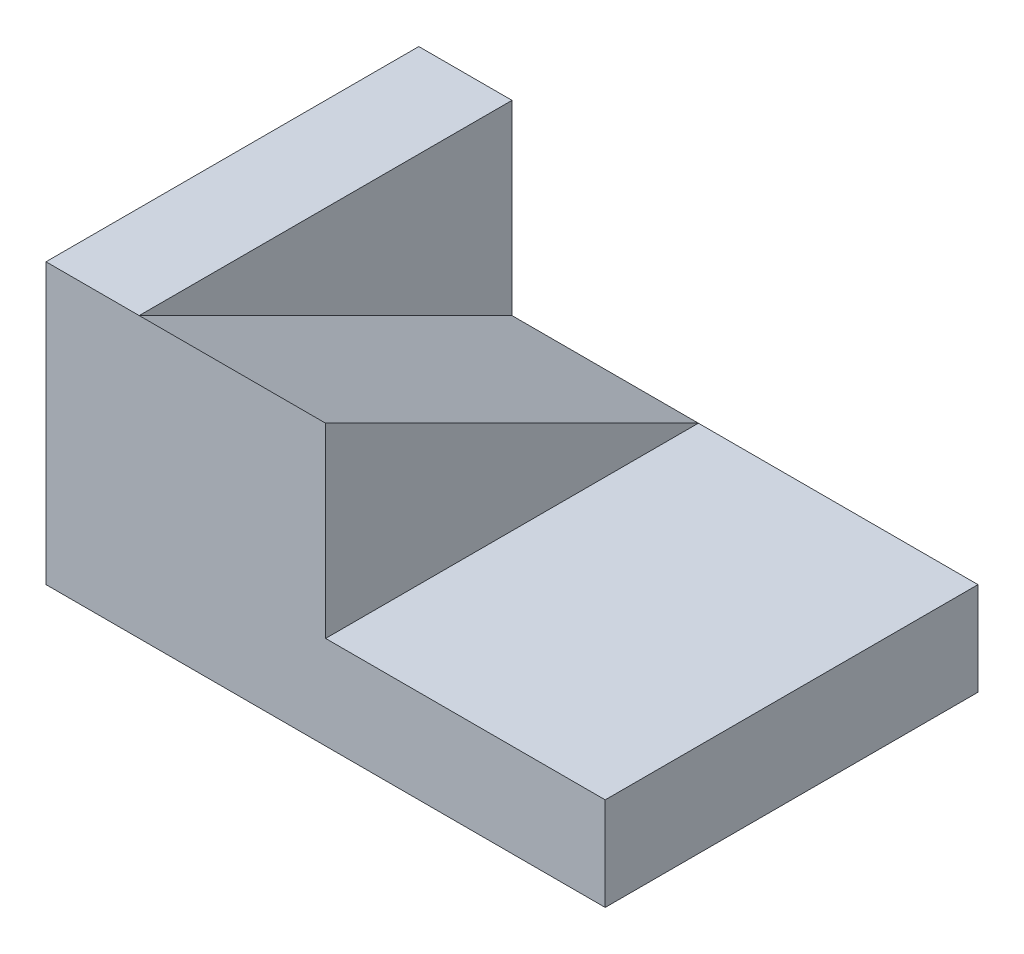
from build123d import *

# Parameters (mm, degrees)
SKETCH1_W           = 40
SKETCH1_H           = 30
BOSS_EXTRUDE2_DEPTH = 10
SKETCH1_4_W         = 40
SKETCH1_4_H         = 10
BOSS_EXTRUDE3_DEPTH = 60
BOSS_EXTRUDE4_DEPTH = 30


with BuildPart() as part:
    # Sketch1 → Boss-Extrude2 (new body)
    with BuildSketch(Plane(origin=(0, 0, 0), x_dir=(0, 0, -1), z_dir=(1, 0, 0))):
        with Locations((20, 15)):
            Rectangle(SKETCH1_W, SKETCH1_H)
    extrude(amount=BOSS_EXTRUDE2_DEPTH)

    # Sketch1<4> → Boss-Extrude3 (add)
    with BuildSketch(Plane(origin=(0, 0, 0), x_dir=(0, 0, -1), z_dir=(1, 0, 0))):
        with Locations((20, 5)):
            Rectangle(SKETCH1_4_W, SKETCH1_4_H)
    extrude(amount=BOSS_EXTRUDE3_DEPTH)

    # Sketch1<6> → Boss-Extrude4 (add)
    with BuildSketch(Plane(origin=(0, 0, 0), x_dir=(0, 0, -1), z_dir=(1, 0, 0))):
        Polygon((0, 30), (0, 10), (40, 10), align=None)
    extrude(amount=BOSS_EXTRUDE4_DEPTH)


solid = part.part
